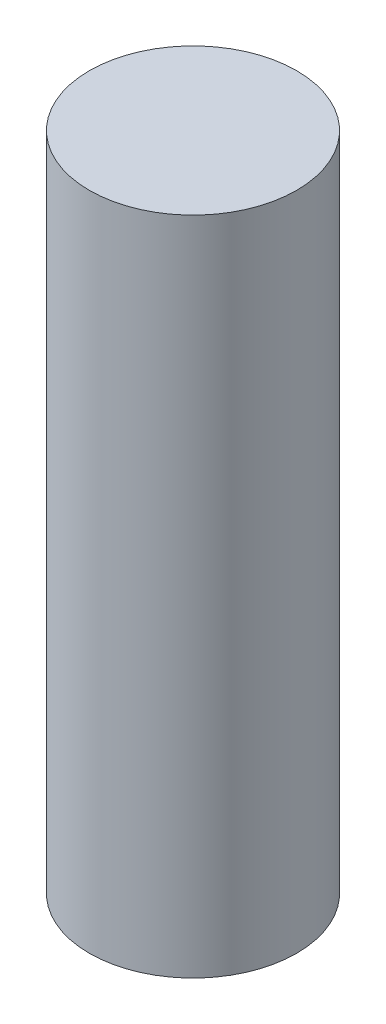
from build123d import *

# Parameters (mm, degrees)
SKETCH_1_W = 4
SKETCH_1_H = 25.5


with BuildPart() as part:
    # 草图1 → Revolve 2 (revolve)
    with BuildSketch(Plane.XY, mode=Mode.PRIVATE) as revolve_2_sk:
        with Locations((2, 12.75)):
            Rectangle(SKETCH_1_W, SKETCH_1_H)
    revolve(revolve_2_sk.sketch.rotate(Axis((0, 0, 0), (0, 1, 0)), 90), axis=Axis((0, 0, 0), (0, 1, 0)))


solid = part.part
